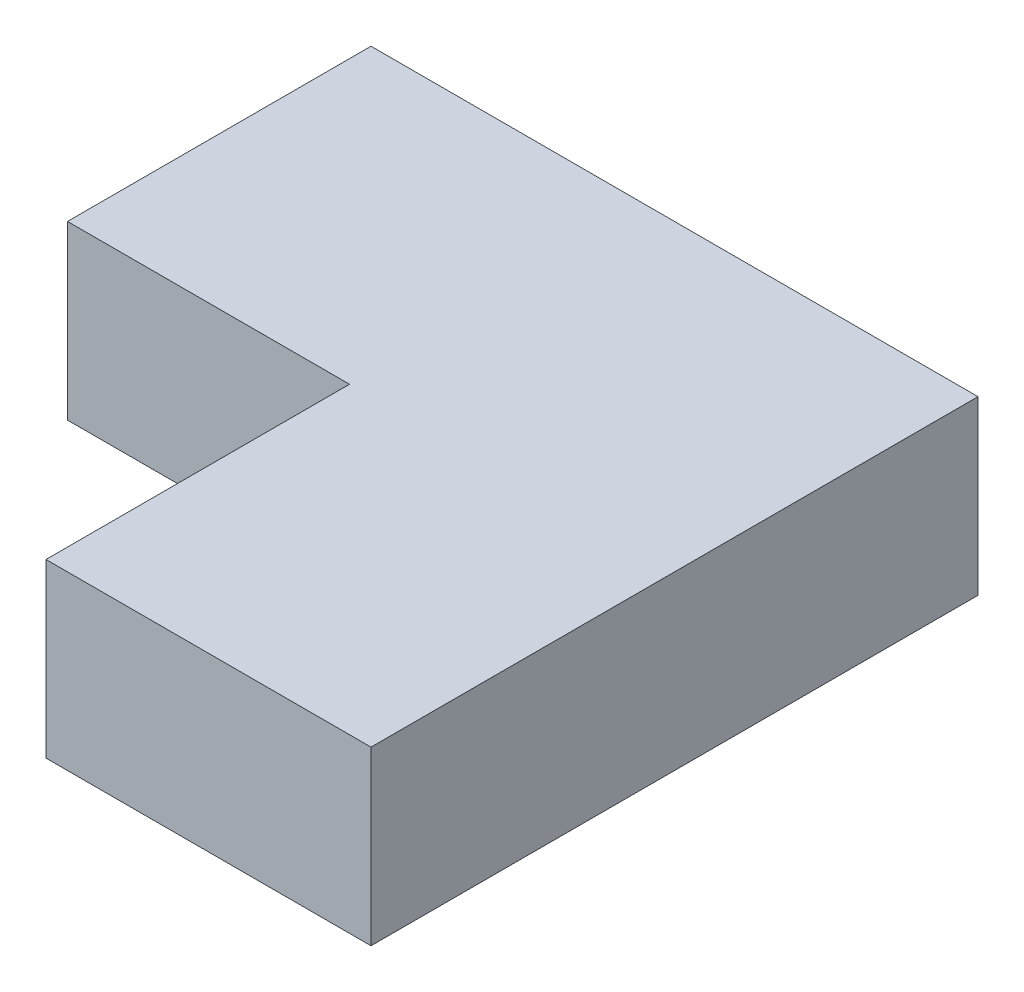
from build123d import *

# Parameters (mm, degrees)
SKETCH1_W           = 45.956077194
SKETCH1_H           = 60.759300765
BOSS_EXTRUDE1_DEPTH = 4.800000052
SKETCH2_W           = 36.889410711
SKETCH2_H           = 52.292642565
CUT_EXTRUDE1_DEPTH  = 105.99289819
SKETCH3_W           = 9.066666483
SKETCH3_H           = 43.825967432
CUT_EXTRUDE3_DEPTH  = 105.99289819
SKETCH4_W           = 29.02274386
SKETCH4_H           = 8.4666582
CUT_EXTRUDE4_DEPTH  = 90.963914511


with BuildPart() as part:
    # Sketch1 → Boss-Extrude1 (new body)
    with BuildSketch(Plane(origin=(0, 0, 0), x_dir=(1, 0, 0), z_dir=(0, 1, 0))):
        with Locations((-66.116726553, -24.961035308)):
            Rectangle(SKETCH1_W, SKETCH1_H)
    extrude(amount=BOSS_EXTRUDE1_DEPTH)

    # Sketch2 → Cut-Extrude1 (cut, through all)
    with BuildSketch(Plane(origin=(0, 4.800000052, 0), x_dir=(1, 0, 0), z_dir=(0, 1, 0))):
        with Locations((-70.650059795, -29.194364408)):
            Rectangle(SKETCH2_W, SKETCH2_H)
    extrude(amount=-CUT_EXTRUDE1_DEPTH, mode=Mode.SUBTRACT)

    # Sketch3 → Cut-Extrude3 (cut, through all)
    with BuildSketch(Plane(origin=(0, 4.800000052, 0), x_dir=(1, 0, 0), z_dir=(0, 1, 0))):
        with Locations((-47.672021198, -33.427701974)):
            Rectangle(SKETCH3_W, SKETCH3_H)
    extrude(amount=-CUT_EXTRUDE3_DEPTH, mode=Mode.SUBTRACT)

    # Sketch4 → Cut-Extrude4 (cut, through all)
    with BuildSketch(Plane(origin=(0, 4.800000052, 0), x_dir=(1, 0, 0), z_dir=(0, 1, 0))):
        with Locations((-74.58339322, 1.185285975)):
            Rectangle(SKETCH4_W, SKETCH4_H)
    extrude(amount=-CUT_EXTRUDE4_DEPTH, mode=Mode.SUBTRACT)


solid = part.part
